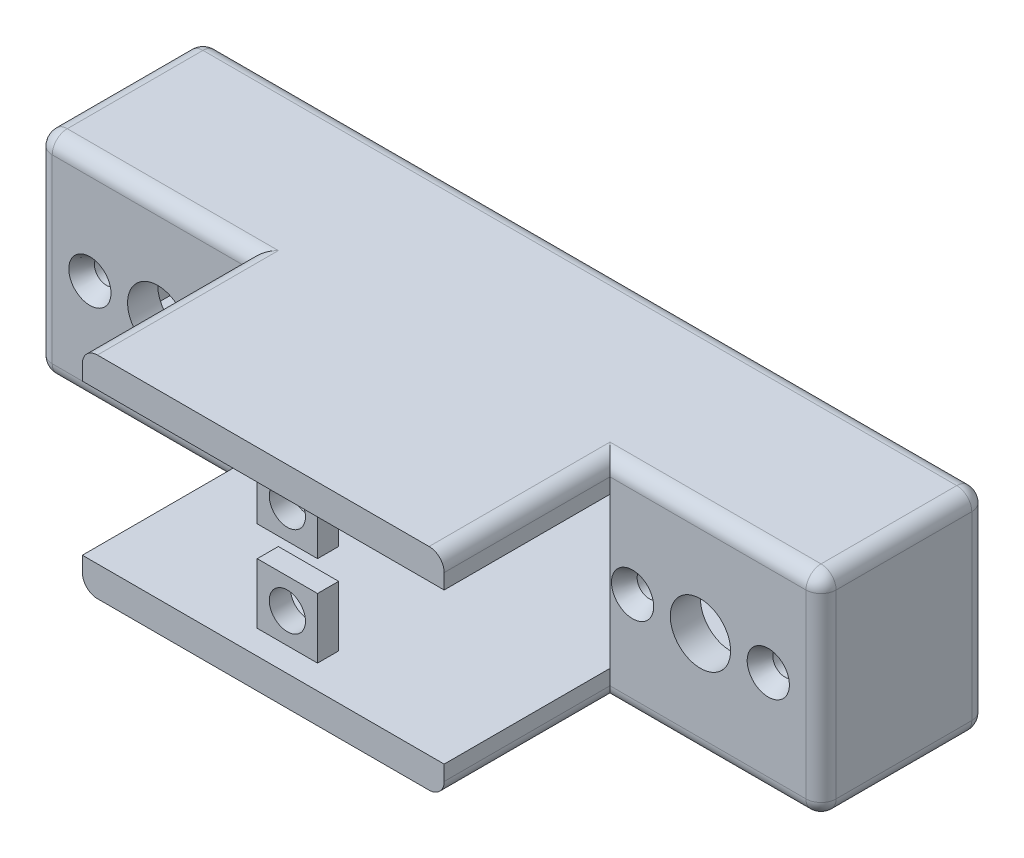
from build123d import *

# Parameters (mm, degrees)
SKETCH_1_W           = 52
SKETCH_1_H           = 14
EXTRUDE_1_DEPTH      = 11
SHELL_1_T            = -2
SKETCH_2_W           = 24
SKETCH_2_H           = 10
CUT_EXTRUDE_1_DEPTH  = 2
SKETCH_3_W           = 24
SKETCH_3_H           = 2
EXTRUDE_2_DEPTH      = 11
SKETCH_8_R           = 2
CUT_EXTRUDE_5_DEPTH  = 2
SKETCH_15_W          = 4
SKETCH_15_H          = 4
EXTRUDE_4_DEPTH      = 3
SKETCH_16_R          = 1.2
CUT_EXTRUDE_10_DEPTH = 10
FILLET_1_R           = 1
SKETCH_17_W          = 24
SKETCH_17_H          = 10
CUT_EXTRUDE_11_DEPTH = 1.6


with BuildPart() as part:
    # 草图1 → 凸台-拉伸1 (new body)
    with BuildSketch(Plane.XY):
        with Locations((26, 7)):
            Rectangle(SKETCH_1_W, SKETCH_1_H)
    extrude(amount=EXTRUDE_1_DEPTH)

    # 抽壳1
    shell_1_openings = [part.faces().sort_by_distance(p)[0] for p in [
        (26, 7, 0),
    ]]
    offset(amount=SHELL_1_T, openings=shell_1_openings, kind=Kind.INTERSECTION)

    # 草图2 → 切除-拉伸1 (cut)
    with BuildSketch(Plane(origin=(0, 0, 9), x_dir=(-1, 0, 0), z_dir=(0, 0, -1))):
        with Locations((-26, 7)):
            Rectangle(SKETCH_2_W, SKETCH_2_H)
    extrude(amount=-CUT_EXTRUDE_1_DEPTH, mode=Mode.SUBTRACT)

    # 草图3 → 凸台-拉伸2 (add)
    with BuildSketch(Plane.XY.offset(11)):
        with Locations((26, 1)):
            Rectangle(SKETCH_3_W, SKETCH_3_H)
        with Locations((26, 13)):
            Rectangle(SKETCH_3_W, SKETCH_3_H)
    extrude(amount=EXTRUDE_2_DEPTH)

    # 草图8 → 切除-拉伸5 (cut)
    with BuildSketch(Plane.XY.offset(11)):
        with Locations((8, 7)):
            Circle(SKETCH_8_R)
        with Locations((44, 7)):
            Circle(SKETCH_8_R)
    extrude(amount=-CUT_EXTRUDE_5_DEPTH, mode=Mode.SUBTRACT)

    # 草图15 → 凸台-拉伸4 (add)
    with BuildSketch(Plane.XY.offset(22)):
        with Locations((26, 4)):
            Rectangle(SKETCH_15_W, SKETCH_15_H)
        with Locations((26, 10)):
            Rectangle(SKETCH_15_W, SKETCH_15_H)
    extrude(amount=-EXTRUDE_4_DEPTH)

    # 草图19 → 切除-旋转6 (revolve, cut)
    with BuildSketch(Plane(origin=(0, 7, 0), x_dir=(1, 0, 0), z_dir=(0, 1, 0)), mode=Mode.PRIVATE) as cut_revolve_6_sk:
        Polygon((2.1, -11), (3.5, -11), (3.5, -9), (2.7, -9), (2.7, -9.9), align=None)
    revolve(cut_revolve_6_sk.sketch.rotate(Axis((3.5, 7, 11), (0, 0, -1)), 270), axis=Axis((3.5, 7, 11), (0, 0, -1)), mode=Mode.SUBTRACT)

    # 草图20 → 切除-旋转7 (revolve, cut)
    with BuildSketch(Plane(origin=(0, 7, 0), x_dir=(1, 0, 0), z_dir=(0, 1, 0)), mode=Mode.PRIVATE) as cut_revolve_7_sk:
        Polygon((11.1, -11), (12.5, -11), (12.5, -9), (11.7, -9), (11.7, -9.9), align=None)
    revolve(cut_revolve_7_sk.sketch.rotate(Axis((12.5, 7, 11), (0, 0, -1)), 270), axis=Axis((12.5, 7, 11), (0, 0, -1)), mode=Mode.SUBTRACT)

    # 草图21 → 切除-旋转8 (revolve, cut)
    with BuildSketch(Plane(origin=(0, 7, 0), x_dir=(1, 0, 0), z_dir=(0, 1, 0)), mode=Mode.PRIVATE) as cut_revolve_8_sk:
        Polygon((38.1, -11), (39.5, -11), (39.5, -9), (38.7, -9), (38.7, -9.9), align=None)
    revolve(cut_revolve_8_sk.sketch.rotate(Axis((39.5, 7, 11), (0, 0, -1)), 270), axis=Axis((39.5, 7, 11), (0, 0, -1)), mode=Mode.SUBTRACT)

    # 草图22 → 切除-旋转9 (revolve, cut)
    with BuildSketch(Plane(origin=(0, 7, 0), x_dir=(1, 0, 0), z_dir=(0, 1, 0)), mode=Mode.PRIVATE) as cut_revolve_9_sk:
        Polygon((47.1, -11), (48.5, -11), (48.5, -9), (47.7, -9), (47.7, -9.9), align=None)
    revolve(cut_revolve_9_sk.sketch.rotate(Axis((48.5, 7, 11), (0, 0, -1)), 270), axis=Axis((48.5, 7, 11), (0, 0, -1)), mode=Mode.SUBTRACT)

    # 草图16 → 切除-拉伸10 (cut)
    with BuildSketch(Plane.XY.offset(22)):
        with Locations((26, 10)):
            Circle(SKETCH_16_R)
        with Locations((26, 4)):
            Circle(SKETCH_16_R)
    extrude(amount=-CUT_EXTRUDE_10_DEPTH, mode=Mode.SUBTRACT)

    # 圆角1
    fillet_1_edges = [part.edges().sort_by_distance(p)[0] for p in [
        (52, 7, 11),
        (45, 14, 11),
        (45, 0, 11),
        (7, 14, 11),
        (38, 0, 16.5),
        (14, 0, 16.5),
        (0, 7, 11),
        (26, 14, 0),
        (14, 14, 16.5),
        (38, 14, 16.5),
        (52, 7, 0),
        (26, 0, 0),
        (0, 7, 0),
        (0, 14, 5.5),
        (52, 14, 5.5),
        (52, 0, 5.5),
        (0, 0, 5.5),
        (7, 0, 11),
    ]]
    fillet(fillet_1_edges, radius=FILLET_1_R)

    # 草图17 → 切除-拉伸11 (cut)
    with BuildSketch(Plane.XY.offset(22)):
        with Locations((26, 7)):
            Rectangle(SKETCH_17_W, SKETCH_17_H)
    extrude(amount=-CUT_EXTRUDE_11_DEPTH, mode=Mode.SUBTRACT)


solid = part.part
